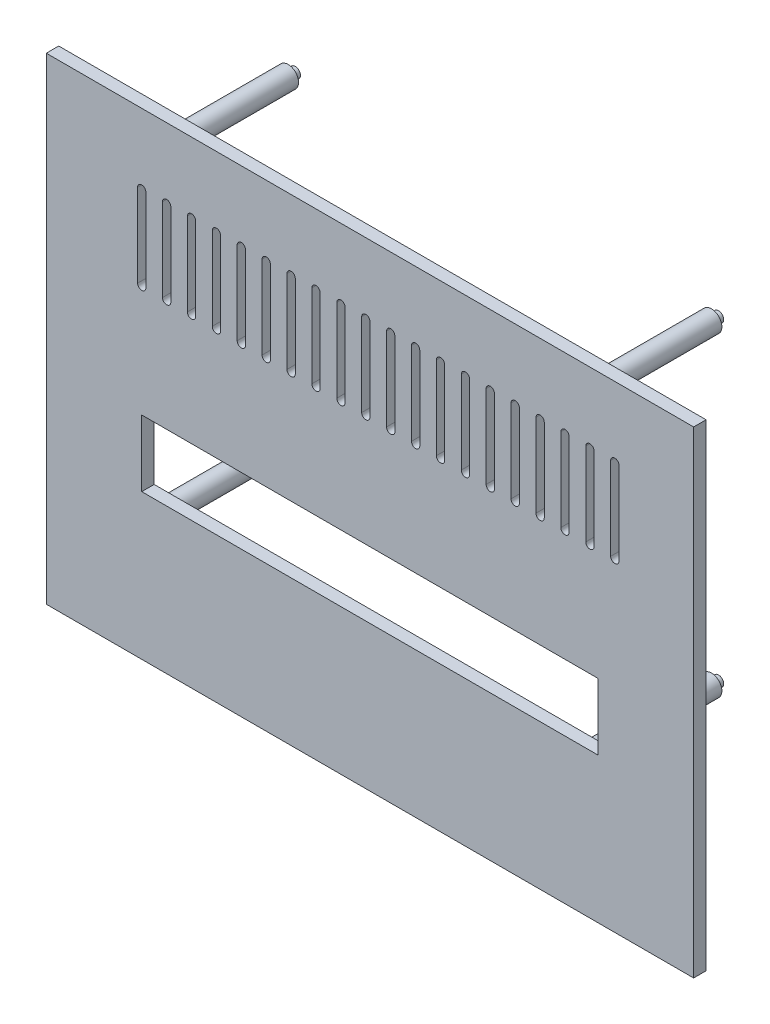
from build123d import *

# Parameters (mm, degrees)
SKETCH_2_W      = 156
SKETCH_2_H      = 115
SKETCH_2_W_2    = 110
SKETCH_2_H_2    = 16
EXTRUDE_1_DEPTH = 3
SKETCH_1_W      = 150
SKETCH_1_H      = 110
SKETCH_1_W_2    = 144
SKETCH_1_H_2    = 104
EXTRUDE_2_DEPTH = 2
SKETCH_3_R      = 2.5
EXTRUDE_3_DEPTH = 28.3
SKETCH_5_R      = 1.25
EXTRUDE_4_DEPTH = 1.7


with BuildPart() as part:
    # 草图2 → 凸台-拉伸1 (new body)
    with BuildSketch(Plane.XY.offset(-2003.6216566)):
        with Locations((145.628836913, 15.276761468)):
            Rectangle(SKETCH_2_W, SKETCH_2_H)
        with Locations((145.628836913, 0.776761468)):
            Rectangle(SKETCH_2_W_2, SKETCH_2_H_2, mode=Mode.SUBTRACT)
        with BuildLine():
            Line((89.628836913, 35.776761468), (89.628836913, 55.776761468))
            ThreePointArc((89.628836913, 55.776761468), (90.628836913, 56.776761468), (91.628836913, 55.776761468))
            Line((91.628836913, 55.776761468), (91.628836913, 35.776761468))
            ThreePointArc((91.628836913, 35.776761468), (90.628836913, 34.776761468), (89.628836913, 35.776761468))
        make_face(mode=Mode.SUBTRACT)
        with BuildLine():
            Line((95.628836913, 35.776761468), (95.628836913, 55.776761468))
            ThreePointArc((95.628836913, 55.776761468), (96.628836913, 56.776761468), (97.628836913, 55.776761468))
            Line((97.628836913, 55.776761468), (97.628836913, 35.776761468))
            ThreePointArc((97.628836913, 35.776761468), (96.628836913, 34.776761468), (95.628836913, 35.776761468))
        make_face(mode=Mode.SUBTRACT)
        with BuildLine():
            Line((101.628836913, 35.776761468), (101.628836913, 55.776761468))
            ThreePointArc((101.628836913, 55.776761468), (102.628836913, 56.776761468), (103.628836913, 55.776761468))
            Line((103.628836913, 55.776761468), (103.628836913, 35.776761468))
            ThreePointArc((103.628836913, 35.776761468), (102.628836913, 34.776761468), (101.628836913, 35.776761468))
        make_face(mode=Mode.SUBTRACT)
        with BuildLine():
            Line((107.628836913, 35.776761468), (107.628836913, 55.776761468))
            ThreePointArc((107.628836913, 55.776761468), (108.628836913, 56.776761468), (109.628836913, 55.776761468))
            Line((109.628836913, 55.776761468), (109.628836913, 35.776761468))
            ThreePointArc((109.628836913, 35.776761468), (108.628836913, 34.776761468), (107.628836913, 35.776761468))
        make_face(mode=Mode.SUBTRACT)
        with BuildLine():
            Line((113.628836913, 35.776761468), (113.628836913, 55.776761468))
            ThreePointArc((113.628836913, 55.776761468), (114.628836913, 56.776761468), (115.628836913, 55.776761468))
            Line((115.628836913, 55.776761468), (115.628836913, 35.776761468))
            ThreePointArc((115.628836913, 35.776761468), (114.628836913, 34.776761468), (113.628836913, 35.776761468))
        make_face(mode=Mode.SUBTRACT)
        with BuildLine():
            Line((119.628836913, 35.776761468), (119.628836913, 55.776761468))
            ThreePointArc((119.628836913, 55.776761468), (120.628836913, 56.776761468), (121.628836913, 55.776761468))
            Line((121.628836913, 55.776761468), (121.628836913, 35.776761468))
            ThreePointArc((121.628836913, 35.776761468), (120.628836913, 34.776761468), (119.628836913, 35.776761468))
        make_face(mode=Mode.SUBTRACT)
        with BuildLine():
            Line((125.628836913, 35.776761468), (125.628836913, 55.776761468))
            ThreePointArc((125.628836913, 55.776761468), (126.628836913, 56.776761468), (127.628836913, 55.776761468))
            Line((127.628836913, 55.776761468), (127.628836913, 35.776761468))
            ThreePointArc((127.628836913, 35.776761468), (126.628836913, 34.776761468), (125.628836913, 35.776761468))
        make_face(mode=Mode.SUBTRACT)
        with BuildLine():
            Line((131.628836913, 35.776761468), (131.628836913, 55.776761468))
            ThreePointArc((131.628836913, 55.776761468), (132.628836913, 56.776761468), (133.628836913, 55.776761468))
            Line((133.628836913, 55.776761468), (133.628836913, 35.776761468))
            ThreePointArc((133.628836913, 35.776761468), (132.628836913, 34.776761468), (131.628836913, 35.776761468))
        make_face(mode=Mode.SUBTRACT)
        with BuildLine():
            Line((137.628836913, 35.776761468), (137.628836913, 55.776761468))
            ThreePointArc((137.628836913, 55.776761468), (138.628836913, 56.776761468), (139.628836913, 55.776761468))
            Line((139.628836913, 55.776761468), (139.628836913, 35.776761468))
            ThreePointArc((139.628836913, 35.776761468), (138.628836913, 34.776761468), (137.628836913, 35.776761468))
        make_face(mode=Mode.SUBTRACT)
        with BuildLine():
            Line((143.628836913, 35.776761468), (143.628836913, 55.776761468))
            ThreePointArc((143.628836913, 55.776761468), (144.628836913, 56.776761468), (145.628836913, 55.776761468))
            Line((145.628836913, 55.776761468), (145.628836913, 35.776761468))
            ThreePointArc((145.628836913, 35.776761468), (144.628836913, 34.776761468), (143.628836913, 35.776761468))
        make_face(mode=Mode.SUBTRACT)
        with BuildLine():
            Line((149.628836913, 35.776761468), (149.628836913, 55.776761468))
            ThreePointArc((149.628836913, 55.776761468), (150.628836913, 56.776761468), (151.628836913, 55.776761468))
            Line((151.628836913, 55.776761468), (151.628836913, 35.776761468))
            ThreePointArc((151.628836913, 35.776761468), (150.628836913, 34.776761468), (149.628836913, 35.776761468))
        make_face(mode=Mode.SUBTRACT)
        with BuildLine():
            Line((155.628836913, 35.776761468), (155.628836913, 55.776761468))
            ThreePointArc((155.628836913, 55.776761468), (156.628836913, 56.776761468), (157.628836913, 55.776761468))
            Line((157.628836913, 55.776761468), (157.628836913, 35.776761468))
            ThreePointArc((157.628836913, 35.776761468), (156.628836913, 34.776761468), (155.628836913, 35.776761468))
        make_face(mode=Mode.SUBTRACT)
        with BuildLine():
            Line((161.628836913, 35.776761468), (161.628836913, 55.776761468))
            ThreePointArc((161.628836913, 55.776761468), (162.628836913, 56.776761468), (163.628836913, 55.776761468))
            Line((163.628836913, 55.776761468), (163.628836913, 35.776761468))
            ThreePointArc((163.628836913, 35.776761468), (162.628836913, 34.776761468), (161.628836913, 35.776761468))
        make_face(mode=Mode.SUBTRACT)
        with BuildLine():
            Line((167.628836913, 35.776761468), (167.628836913, 55.776761468))
            ThreePointArc((167.628836913, 55.776761468), (168.628836913, 56.776761468), (169.628836913, 55.776761468))
            Line((169.628836913, 55.776761468), (169.628836913, 35.776761468))
            ThreePointArc((169.628836913, 35.776761468), (168.628836913, 34.776761468), (167.628836913, 35.776761468))
        make_face(mode=Mode.SUBTRACT)
        with BuildLine():
            Line((173.628836913, 35.776761468), (173.628836913, 55.776761468))
            ThreePointArc((173.628836913, 55.776761468), (174.628836913, 56.776761468), (175.628836913, 55.776761468))
            Line((175.628836913, 55.776761468), (175.628836913, 35.776761468))
            ThreePointArc((175.628836913, 35.776761468), (174.628836913, 34.776761468), (173.628836913, 35.776761468))
        make_face(mode=Mode.SUBTRACT)
        with BuildLine():
            Line((179.628836913, 35.776761468), (179.628836913, 55.776761468))
            ThreePointArc((179.628836913, 55.776761468), (180.628836913, 56.776761468), (181.628836913, 55.776761468))
            Line((181.628836913, 55.776761468), (181.628836913, 35.776761468))
            ThreePointArc((181.628836913, 35.776761468), (180.628836913, 34.776761468), (179.628836913, 35.776761468))
        make_face(mode=Mode.SUBTRACT)
        with BuildLine():
            Line((185.628836913, 35.776761468), (185.628836913, 55.776761468))
            ThreePointArc((185.628836913, 55.776761468), (186.628836913, 56.776761468), (187.628836913, 55.776761468))
            Line((187.628836913, 55.776761468), (187.628836913, 35.776761468))
            ThreePointArc((187.628836913, 35.776761468), (186.628836913, 34.776761468), (185.628836913, 35.776761468))
        make_face(mode=Mode.SUBTRACT)
        with BuildLine():
            Line((191.628836913, 35.776761468), (191.628836913, 55.776761468))
            ThreePointArc((191.628836913, 55.776761468), (192.628836913, 56.776761468), (193.628836913, 55.776761468))
            Line((193.628836913, 55.776761468), (193.628836913, 35.776761468))
            ThreePointArc((193.628836913, 35.776761468), (192.628836913, 34.776761468), (191.628836913, 35.776761468))
        make_face(mode=Mode.SUBTRACT)
        with BuildLine():
            Line((197.628836913, 35.776761468), (197.628836913, 55.776761468))
            ThreePointArc((197.628836913, 55.776761468), (198.628836913, 56.776761468), (199.628836913, 55.776761468))
            Line((199.628836913, 55.776761468), (199.628836913, 35.776761468))
            ThreePointArc((199.628836913, 35.776761468), (198.628836913, 34.776761468), (197.628836913, 35.776761468))
        make_face(mode=Mode.SUBTRACT)
        with BuildLine():
            Line((203.628836913, 35.776761468), (203.628836913, 55.776761468))
            ThreePointArc((203.628836913, 55.776761468), (204.628836913, 56.776761468), (205.628836913, 55.776761468))
            Line((205.628836913, 55.776761468), (205.628836913, 35.776761468))
            ThreePointArc((205.628836913, 35.776761468), (204.628836913, 34.776761468), (203.628836913, 35.776761468))
        make_face(mode=Mode.SUBTRACT)
    extrude(amount=EXTRUDE_1_DEPTH)

    # 草图1 → 凸台-拉伸2 (add)
    with BuildSketch(Plane.XY.offset(-2003.6216566)):
        with Locations((145.628836913, 15.776761468)):
            Rectangle(SKETCH_1_W, SKETCH_1_H)
        with Locations((145.628836913, 15.776761468)):
            Rectangle(SKETCH_1_W_2, SKETCH_1_H_2, mode=Mode.SUBTRACT)
    extrude(amount=-EXTRUDE_2_DEPTH)

    # 草图3 → 凸台-拉伸3 (add)
    with BuildSketch(Plane(origin=(0, 0, -2003.6216566), x_dir=(-1, 0, 0), z_dir=(0, 0, -1))):
        with Locations(Location((-196.628836913, 65.776761468, 0), (0, 0, 126.869897646))):
            Circle(SKETCH_3_R)
        with Locations(Location((-94.628836913, 65.776761468, 0), (0, 0, 126.869897646))):
            Circle(SKETCH_3_R)
        with Locations(Location((-94.628836913, -10.223238532, 0), (0, 0, 180))):
            Circle(SKETCH_3_R)
        with Locations(Location((-196.628836913, -10.223238532, 0), (0, 0, 180))):
            Circle(SKETCH_3_R)
    extrude(amount=EXTRUDE_3_DEPTH)

    # 草图5 → 凸台-拉伸4 (add)
    with BuildSketch(Plane(origin=(0, 0, -2031.9216566), x_dir=(-1, 0, 0), z_dir=(0, 0, -1))):
        with Locations((-196.628836913, 65.776761468)):
            Circle(SKETCH_5_R)
        with Locations((-94.628836913, 65.776761468)):
            Circle(SKETCH_5_R)
        with Locations((-94.628836913, -10.223238532)):
            Circle(SKETCH_5_R)
        with Locations((-196.628836913, -10.223238532)):
            Circle(SKETCH_5_R)
    extrude(amount=EXTRUDE_4_DEPTH)


solid = part.part
